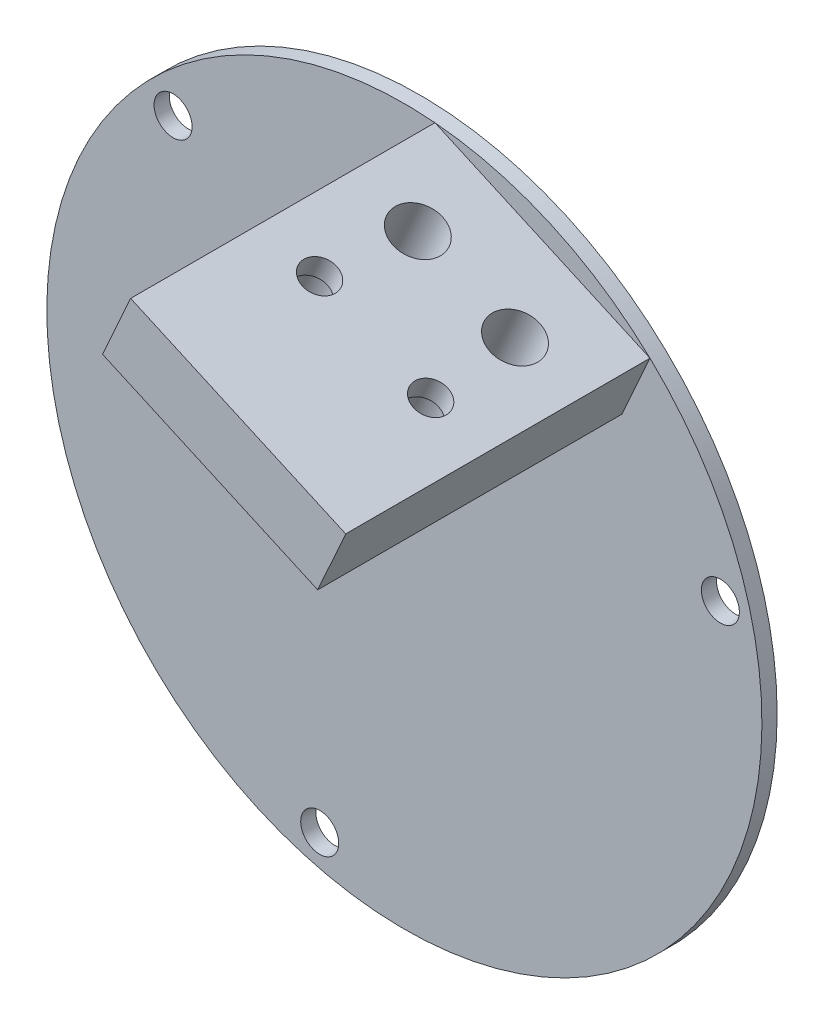
from build123d import *

# Parameters (mm, degrees)
SKETCH1_R           = 47
BOSS_EXTRUDE1_DEPTH = 2
SKETCH3_R           = 2.5
CUT_EXTRUDE1_DEPTH  = 67.498120274
BOSS_EXTRUDE2_DEPTH = 40
CUT_EXTRUDE3_REACH  = 118.892
SKETCH8_R           = 3.25
SKETCH8_R_2         = 2.25
SKETCH9_W           = 11
SKETCH9_H           = 13
CUT_EXTRUDE4_DEPTH  = 1
CUT_EXTRUDE5_DEPTH  = 6


with BuildPart() as part:
    # Sketch1 → Boss-Extrude1 (new body)
    with BuildSketch(Plane.XY):
        Circle(SKETCH1_R)
    extrude(amount=BOSS_EXTRUDE1_DEPTH)

    # Sketch3 → Cut-Extrude1 (cut, through all)
    with BuildSketch(Plane(origin=(0, 0, 0), x_dir=(-1, 0, 0), z_dir=(0, 0, -1))):
        with Locations((30.405591591, 30.405591591)):
            Circle(SKETCH3_R)
        with Locations((11.129218939, -41.53481053)):
            Circle(SKETCH3_R)
        with Locations((-41.53481053, 11.129218939)):
            Circle(SKETCH3_R)
    extrude(amount=-CUT_EXTRUDE1_DEPTH, mode=Mode.SUBTRACT)

    # Sketch4 → Boss-Extrude2 (add)
    with BuildSketch(Plane.XY.offset(2)):
        Polygon((4.020989493, 46.827680313), (32.287890293, 34.153947655), (28.605815439, 25.941620045), (0.338914639, 38.615352703), align=None)
    extrude(amount=BOSS_EXTRUDE2_DEPTH)

    # Sketch8 → Cut-Extrude3 (cut, up to next)
    with BuildSketch(Plane(origin=(18.154439893, 40.490813984, 0), x_dir=(0.9124808455439009, -0.4091194281814147, 0), z_dir=(0.4091194281814148, 0.912480845543901, 0)), mode=Mode.PRIVATE) as cut_extrude3_sk1:
        with Locations(Location((7, -12, 0), (0, 0, 180))):
            Circle(SKETCH8_R)
    cut_extrude3_tool1 = extrude(cut_extrude3_sk1.sketch, amount=-CUT_EXTRUDE3_REACH, mode=Mode.PRIVATE) & part.part
    # Sketch8 → Cut-Extrude3 (cut, up to next)
    with BuildSketch(Plane(origin=(18.154439893, 40.490813984, 0), x_dir=(0.9124808455439009, -0.4091194281814147, 0), z_dir=(0.4091194281814148, 0.912480845543901, 0)), mode=Mode.PRIVATE) as cut_extrude3_sk2:
        with Locations(Location((-7, -12, 0), (0, 0, 180))):
            Circle(SKETCH8_R)
    cut_extrude3_tool2 = extrude(cut_extrude3_sk2.sketch, amount=-CUT_EXTRUDE3_REACH, mode=Mode.PRIVATE) & part.part
    # Sketch8 → Cut-Extrude3 (cut, up to next)
    with BuildSketch(Plane(origin=(18.154439893, 40.490813984, 0), x_dir=(0.9124808455439009, -0.4091194281814147, 0), z_dir=(0.4091194281814148, 0.912480845543901, 0)), mode=Mode.PRIVATE) as cut_extrude3_sk3:
        with Locations(Location((8, -24, 0), (0, 0, 180))):
            Circle(SKETCH8_R_2)
    cut_extrude3_tool3 = extrude(cut_extrude3_sk3.sketch, amount=-CUT_EXTRUDE3_REACH, mode=Mode.PRIVATE) & part.part
    # Sketch8 → Cut-Extrude3 (cut, up to next)
    with BuildSketch(Plane(origin=(18.154439893, 40.490813984, 0), x_dir=(0.9124808455439009, -0.4091194281814147, 0), z_dir=(0.4091194281814148, 0.912480845543901, 0)), mode=Mode.PRIVATE) as cut_extrude3_sk4:
        with Locations(Location((-8, -24, 0), (0, 0, 180))):
            Circle(SKETCH8_R_2)
    cut_extrude3_tool4 = extrude(cut_extrude3_sk4.sketch, amount=-CUT_EXTRUDE3_REACH, mode=Mode.PRIVATE) & part.part
    add(cut_extrude3_tool1.solids().sort_by_distance((24.541806, 37.626978, 12))[0], mode=Mode.SUBTRACT)
    add(cut_extrude3_tool2.solids().sort_by_distance((11.767074, 43.35465, 12))[0], mode=Mode.SUBTRACT)
    add(cut_extrude3_tool3.solids().sort_by_distance((25.454287, 37.217859, 24))[0], mode=Mode.SUBTRACT)
    add(cut_extrude3_tool4.solids().sort_by_distance((10.854593, 43.763769, 24))[0], mode=Mode.SUBTRACT)

    # Sketch9 → Cut-Extrude4 (cut)
    with BuildSketch(Plane(origin=(14.472365039, 32.278486374, 0), x_dir=(0.9124808455439007, -0.40911942818141506, 0), z_dir=(-0.40911942818141506, -0.9124808455439007, 0))):
        with Locations((-7, 12)):
            Rectangle(SKETCH9_W, SKETCH9_H)
        with Locations((7, 12)):
            Rectangle(SKETCH9_W, SKETCH9_H)
    extrude(amount=-CUT_EXTRUDE4_DEPTH, mode=Mode.SUBTRACT)

    # Sketch10 → Cut-Extrude5 (cut)
    with BuildSketch(Plane(origin=(14.472365039, 32.278486374, 0), x_dir=(0.9124808455439007, -0.40911942818141506, 0), z_dir=(-0.40911942818141506, -0.9124808455439007, 0))):
        with BuildLine():
            Line((5.25, 25.198957881), (5.25, 22.801042119))
            ThreePointArc((5.25, 22.801042119), (11, 24), (5.25, 25.198957881))
        make_face()
        with BuildLine():
            Line((-5.25, 25.198957881), (-5.25, 22.801042119))
            ThreePointArc((-5.25, 22.801042119), (-11, 24), (-5.25, 25.198957881))
        make_face()
    extrude(amount=-CUT_EXTRUDE5_DEPTH, mode=Mode.SUBTRACT)


solid = part.part
